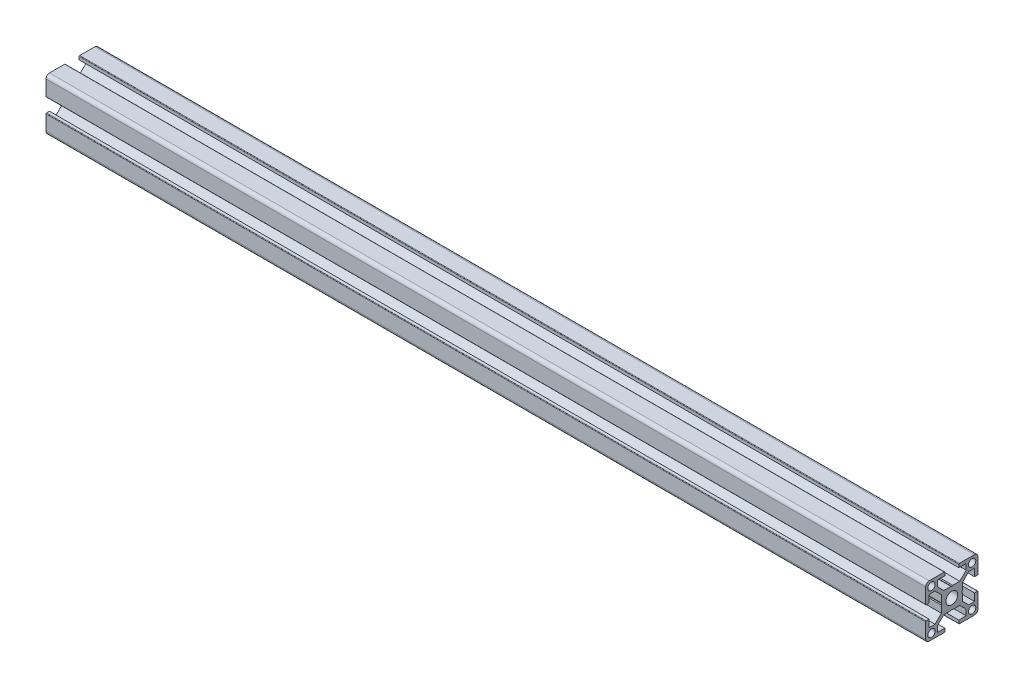
from build123d import *

# Parameters (mm, degrees)
SKETCH_1_R              = 2.1
SKETCH_1_R_2            = 3.4
F_30XS6_30X30S6_1_DEPTH = 504


with BuildPart() as part:
    # 草图1 → 30xs6 30X30S6(1) (new body)
    with BuildSketch(Plane.YZ):
        with BuildLine():
            Line((-14.7, 4), (-13, 4))
            Line((-13, 4), (-13, 8.25))
            Line((-13, 8.25), (-9.664213562, 8.25))
            Line((-9.664213562, 8.25), (-6, 4.585786438))
            Line((-6, 4.585786438), (-6, 0.519615242))
            Line((-6, 0.519615242), (-5.7, 0))
            Line((-5.7, 0), (-6, -0.519615242))
            Line((-6, -0.519615242), (-6, -4.585786438))
            Line((-6, -4.585786438), (-9.664213562, -8.25))
            Line((-9.664213562, -8.25), (-13, -8.25))
            Line((-13, -8.25), (-13, -4))
            Line((-13, -4), (-14.7, -4))
            ThreePointArc((-14.7, -4), (-14.912132034, -4.087867966), (-15, -4.3))
            Line((-15, -4.3), (-15, -13))
            ThreePointArc((-15, -13), (-14.414213562, -14.414213562), (-13, -15))
            Line((-13, -15), (-4.3, -15))
            ThreePointArc((-4.3, -15), (-4.087867966, -14.912132034), (-4, -14.7))
            Line((-4, -14.7), (-4, -13))
            Line((-4, -13), (-8.25, -13))
            Line((-8.25, -13), (-8.25, -9.664213562))
            Line((-8.25, -9.664213562), (-4.585786438, -6))
            Line((-4.585786438, -6), (-0.519615242, -6))
            Line((-0.519615242, -6), (0, -5.7))
            Line((0, -5.7), (0.519615242, -6))
            Line((0.519615242, -6), (4.585786438, -6))
            Line((4.585786438, -6), (8.25, -9.664213562))
            Line((8.25, -9.664213562), (8.25, -13))
            Line((8.25, -13), (4, -13))
            Line((4, -13), (4, -14.7))
            ThreePointArc((4, -14.7), (4.087867966, -14.912132034), (4.3, -15))
            Line((4.3, -15), (13, -15))
            ThreePointArc((13, -15), (14.414213562, -14.414213562), (15, -13))
            Line((15, -13), (15, -4.3))
            ThreePointArc((15, -4.3), (14.912132034, -4.087867966), (14.7, -4))
            Line((14.7, -4), (13, -4))
            Line((13, -4), (13, -8.25))
            Line((13, -8.25), (9.664213562, -8.25))
            Line((9.664213562, -8.25), (6, -4.585786438))
            Line((6, -4.585786438), (6, -0.519615242))
            Line((6, -0.519615242), (5.7, 0))
            Line((5.7, 0), (6, 0.519615242))
            Line((6, 0.519615242), (6, 4.585786438))
            Line((6, 4.585786438), (9.664213562, 8.25))
            Line((9.664213562, 8.25), (13, 8.25))
            Line((13, 8.25), (13, 4))
            Line((13, 4), (14.7, 4))
            ThreePointArc((14.7, 4), (14.912132034, 4.087867966), (15, 4.3))
            Line((15, 4.3), (15, 13))
            ThreePointArc((15, 13), (14.414213562, 14.414213562), (13, 15))
            Line((13, 15), (4.3, 15))
            ThreePointArc((4.3, 15), (4.087867966, 14.912132034), (4, 14.7))
            Line((4, 14.7), (4, 13))
            Line((4, 13), (8.25, 13))
            Line((8.25, 13), (8.25, 9.664213562))
            Line((8.25, 9.664213562), (4.585786438, 6))
            Line((4.585786438, 6), (0.519615242, 6))
            Line((0.519615242, 6), (0, 5.7))
            Line((0, 5.7), (-0.519615242, 6))
            Line((-0.519615242, 6), (-4.585786438, 6))
            Line((-4.585786438, 6), (-8.25, 9.664213562))
            Line((-8.25, 9.664213562), (-8.25, 13))
            Line((-8.25, 13), (-4, 13))
            Line((-4, 13), (-4, 14.7))
            ThreePointArc((-4, 14.7), (-4.087867966, 14.912132034), (-4.3, 15))
            Line((-4.3, 15), (-13, 15))
            ThreePointArc((-13, 15), (-14.414213562, 14.414213562), (-15, 13))
            Line((-15, 13), (-15, 4.3))
            ThreePointArc((-15, 4.3), (-14.912132034, 4.087867966), (-14.7, 4))
        make_face()
        with Locations((11.625, 11.625)):
            Circle(SKETCH_1_R, mode=Mode.SUBTRACT)
        with Locations((11.625, -11.625)):
            Circle(SKETCH_1_R, mode=Mode.SUBTRACT)
        Circle(SKETCH_1_R_2, mode=Mode.SUBTRACT)
        with Locations((-11.625, -11.625)):
            Circle(SKETCH_1_R, mode=Mode.SUBTRACT)
        with Locations((-11.625, 11.625)):
            Circle(SKETCH_1_R, mode=Mode.SUBTRACT)
    extrude(amount=F_30XS6_30X30S6_1_DEPTH)


solid = part.part
